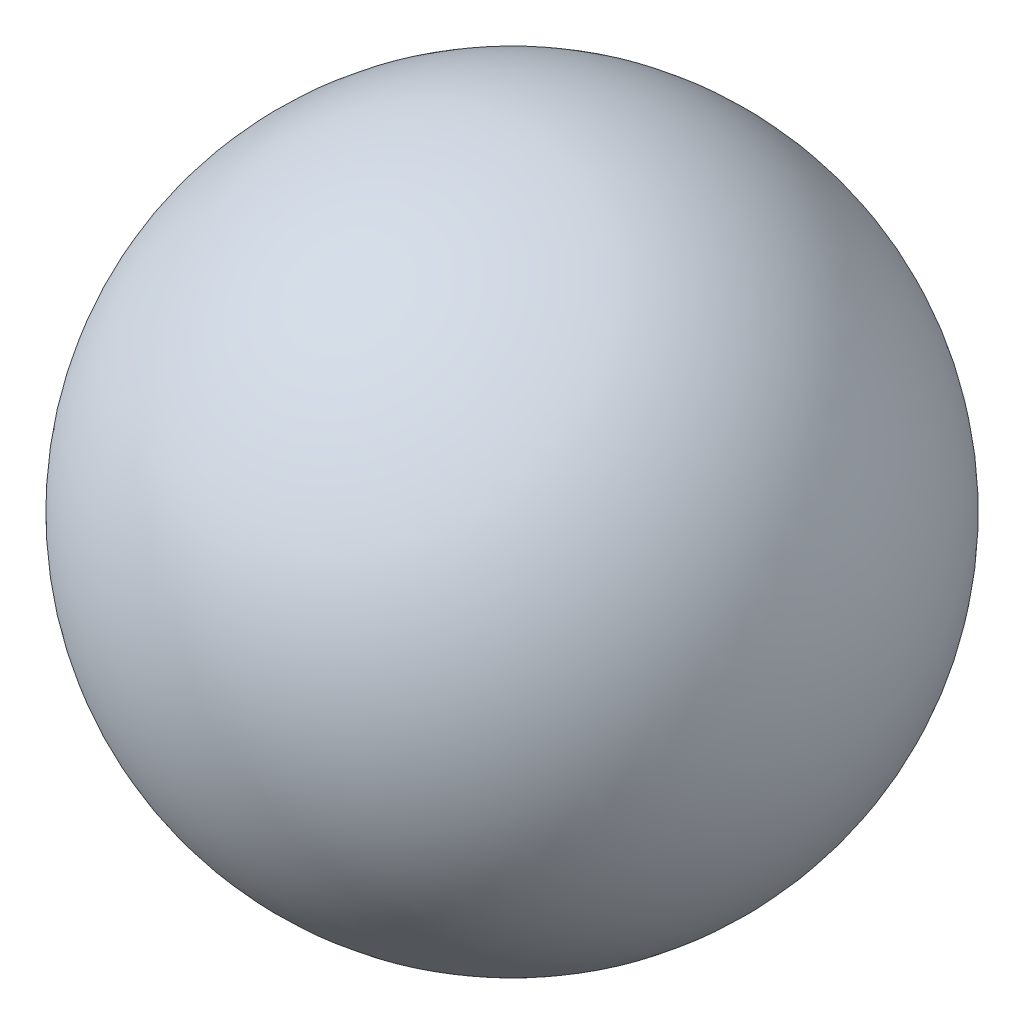
from build123d import *


with BuildPart() as part:
    # Profile → Ball (revolve)
    with BuildSketch(Plane.XY):
        with BuildLine():
            Line((0, 1.25), (0, -1.25))
            ThreePointArc((0, -1.25), (1.25, 0), (0, 1.25))
        make_face()
    revolve(axis=Axis((0, 2.693825656, 0), (0, -1, 0)))


solid = part.part
